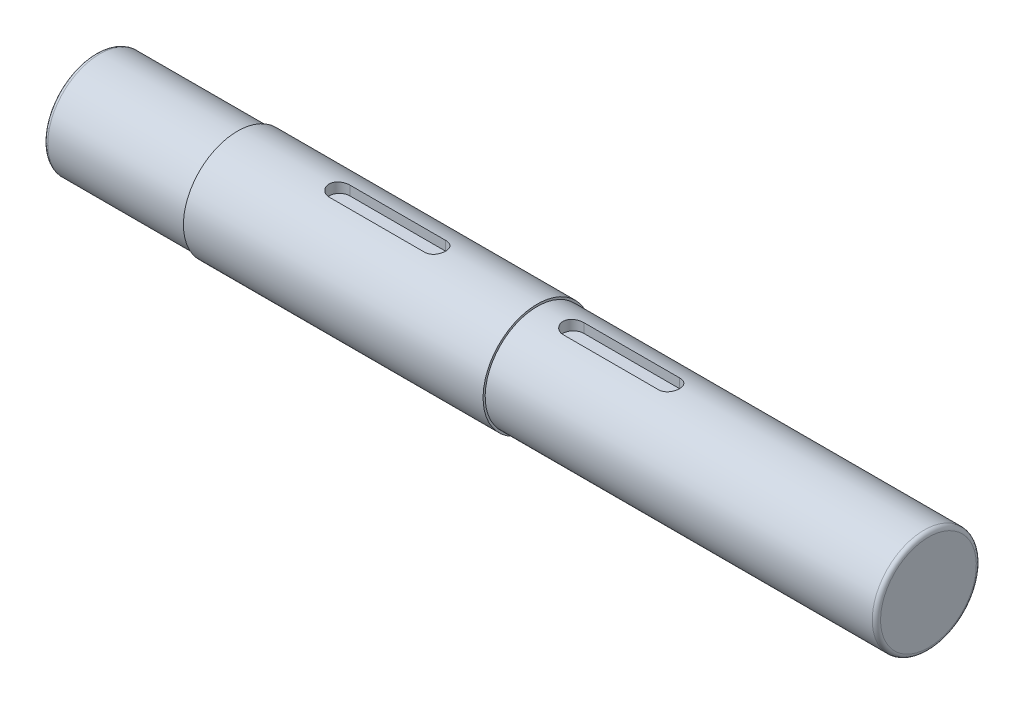
from build123d import *

# Parameters (mm, degrees)
CUT_EXTRUDE1_DEPTH = 2.5
FILLET4_R          = 1
FILLET5_R          = 1
CUT_EXTRUDE3_DEPTH = 2.5


with BuildPart() as part:
    # Sketch1 → Revolve1 (revolve)
    with BuildSketch(Plane.XY, mode=Mode.PRIVATE) as revolve1_sk:
        Polygon((111.690273615, 0), (111.690273615, 12.5), (17.690273615, 12.5), (17.690273615, 13), (-54.309726385, 13), (-54.309726385, 12.5), (-88.409726385, 12.5), (-88.409726385, 0), align=None)
    revolve(revolve1_sk.sketch.rotate(Axis((-88.409726385, 0, 0), (1, 0, 0)), 180), axis=Axis((-88.409726385, 0, 0), (1, 0, 0)))

    # Sketch2 → Cut-Extrude1 (cut)
    with BuildSketch(Plane(origin=(0, 12.5, 0), x_dir=(1, 0, 0), z_dir=(0, 1, 0))):
        with BuildLine():
            Line((26.390273615, 2.5), (49.390273615, 2.5))
            ThreePointArc((49.390273615, 2.5), (51.890273615, 0), (49.390273615, -2.5))
            Line((49.390273615, -2.5), (26.390273615, -2.5))
            ThreePointArc((26.390273615, -2.5), (23.890273615, 0), (26.390273615, 2.5))
        make_face()
    extrude(amount=-CUT_EXTRUDE1_DEPTH, mode=Mode.SUBTRACT)

    # Fillet4
    fillet4_edges = [part.edges().sort_by_distance(p)[0] for p in [
        (111.690273615, 12.5, 0),
    ]]
    fillet(fillet4_edges, radius=FILLET4_R)

    # Fillet5
    fillet5_edges = [part.edges().sort_by_distance(p)[0] for p in [
        (-88.409726385, 12.5, 0),
    ]]
    fillet(fillet5_edges, radius=FILLET5_R)

    # Sketch3 → Cut-Extrude3 (cut)
    with BuildSketch(Plane(origin=(0, 13, 0), x_dir=(1, 0, 0), z_dir=(0, 1, 0))):
        with BuildLine():
            Line((-29.809726385, 2.5), (-6.809726385, 2.5))
            ThreePointArc((-6.809726385, 2.5), (-4.309726385, 0), (-6.809726385, -2.5))
            Line((-6.809726385, -2.5), (-29.809726385, -2.5))
            ThreePointArc((-29.809726385, -2.5), (-32.309726385, 0), (-29.809726385, 2.5))
        make_face()
    extrude(amount=-CUT_EXTRUDE3_DEPTH, mode=Mode.SUBTRACT)


solid = part.part
